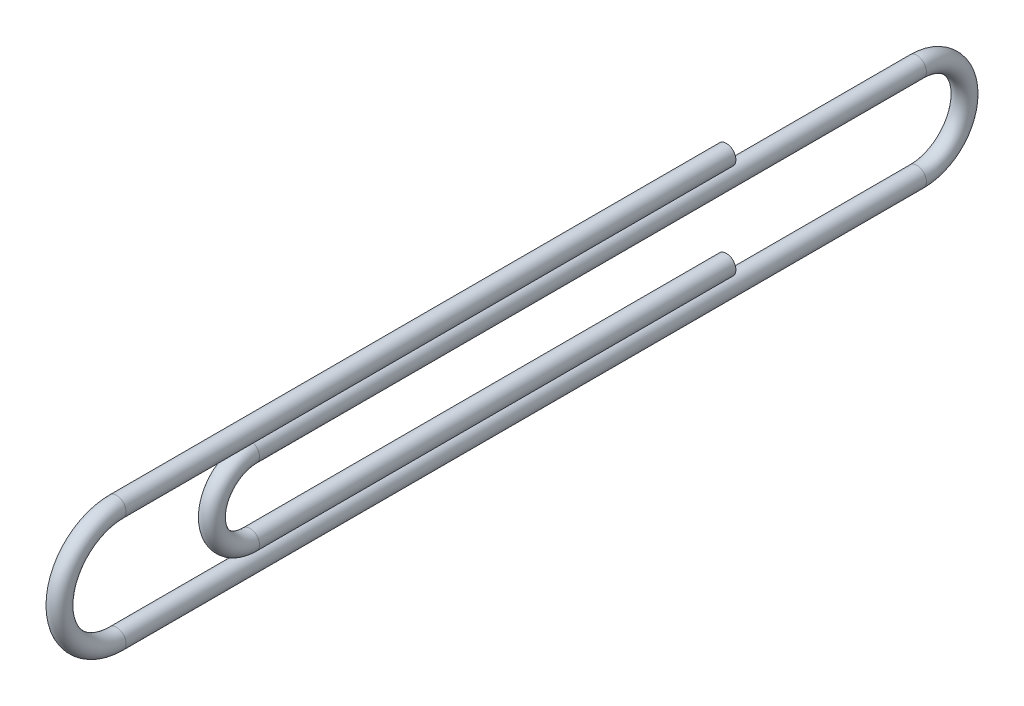
from build123d import *

# Parameters (mm, degrees)
SWEEP12_PROFILE_R = 0.49995


with BuildPart() as part:
    # Sweep12: sweep along a path in Sketch1
    with BuildLine(Plane.YZ) as sweep12_path:
        Line((0, 0), (0, 32))
        ThreePointArc((0, 32), (-3, 35), (-6, 32))
        Line((-6, 32), (-6, -10))
        ThreePointArc((-6, -10), (-3.5, -12.5), (-1, -10))
        Line((-1, -10), (-1, 25))
        ThreePointArc((-1, 25), (-3, 27), (-5, 25))
        Line((-5, 25), (-5, 0))
    # Sweep12 profile (on start of the path) → Sweep12 (sweep)
    with BuildSketch(Plane.XY):
        Circle(SWEEP12_PROFILE_R)
    sweep(path=sweep12_path.line)


solid = part.part
